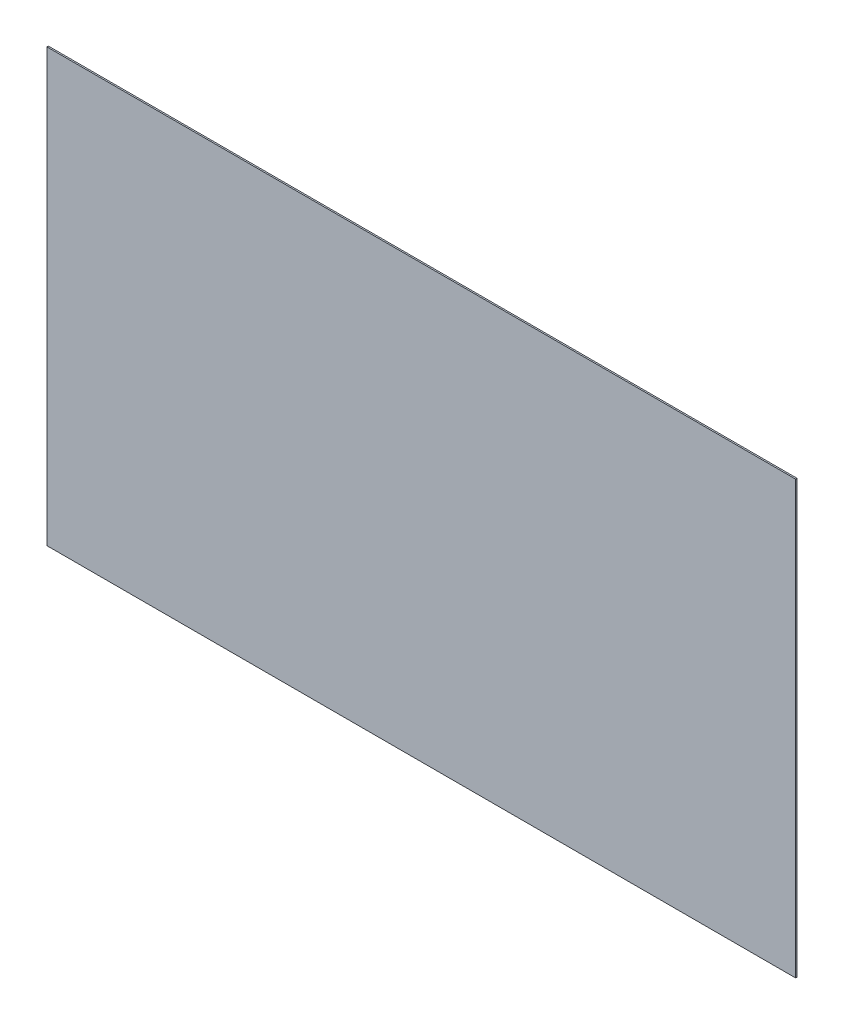
from build123d import *

# Parameters (mm, degrees)
SKETCH_1_W      = 52
SKETCH_1_H      = 30
EXTRUDE_1_DEPTH = 0.1


with BuildPart() as part:
    # 草图1 → 凸台-拉伸1 (new body)
    with BuildSketch(Plane.XY):
        Rectangle(SKETCH_1_W, SKETCH_1_H)
    extrude(amount=EXTRUDE_1_DEPTH)


solid = part.part
